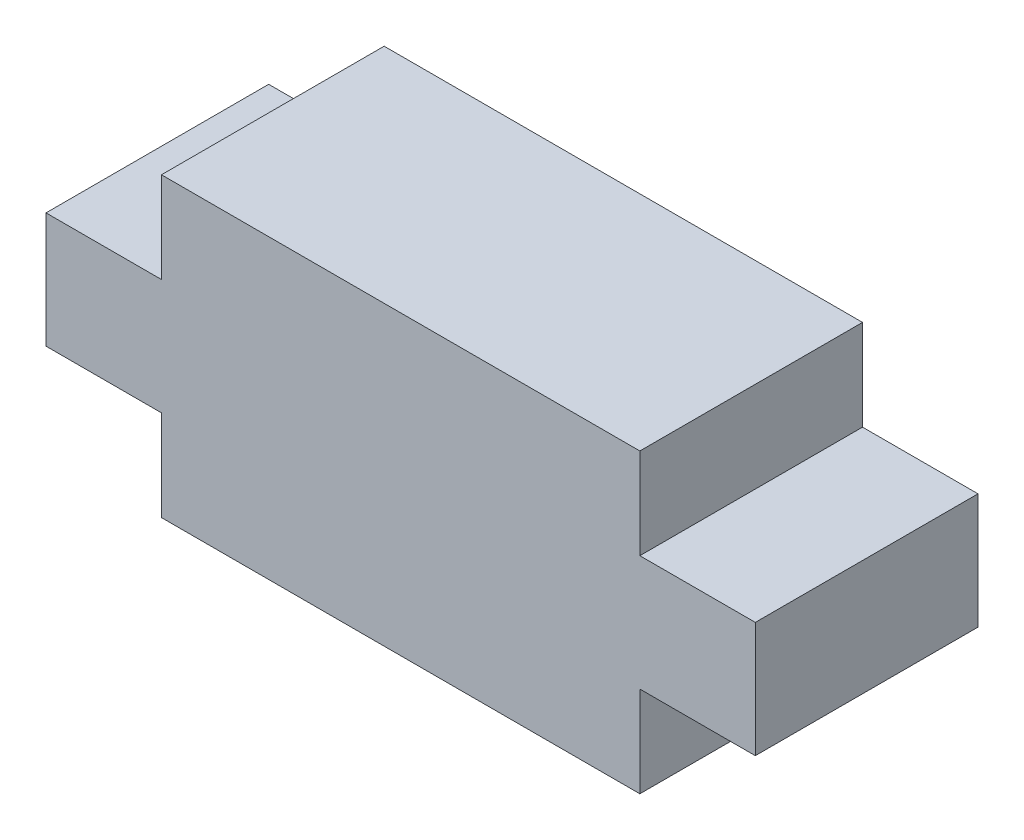
from build123d import *

# Parameters (mm, degrees)
COMPONENT_OUTLINE_DEPTH = 1.35


with BuildPart() as part:
    # 草图1 → Component_Outline (new body)
    with BuildSketch(Plane.XY):
        Polygon((2.15, 0.35), (1.45, 0.35), (1.45, 0.9), (-1.45, 0.9), (-1.45, 0.35), (-2.15, 0.35), (-2.15, -0.35), (-1.45, -0.35), (-1.45, -0.9), (1.45, -0.9), (1.45, -0.35), (2.15, -0.35), align=None)
    extrude(amount=COMPONENT_OUTLINE_DEPTH)


solid = part.part
